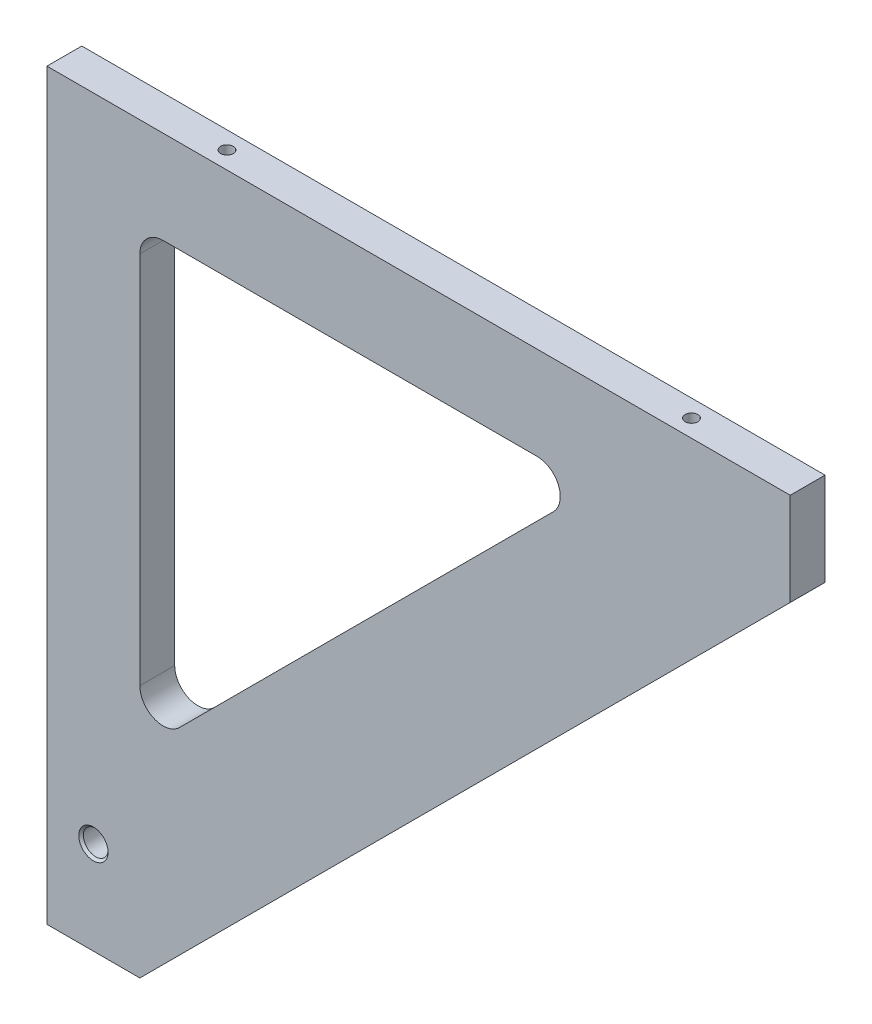
from build123d import *

# Parameters (mm, degrees)
BOSS_EXTRUDE1_DEPTH       = 4.7625
F_8_32_TAPPED_HOLE1_D     = 3.4544
F_8_32_TAPPED_HOLE1_DEPTH = 10.7188
F_8_32_TAPPED_HOLE1_TIP   = 1.037806461
CUT_EXTRUDE1_DEPTH        = 288.526008606
FILLET1_R                 = 6.35


with BuildPart() as part:
    # Sketch1 → Boss-Extrude1 (new, symmetric)
    with BuildSketch(Plane.XY):
        Polygon((0, -203.2), (0, 0), (203.2, 0), (203.2, -25.4), (25.4, -203.2), align=None)
    extrude(amount=BOSS_EXTRUDE1_DEPTH, both=True)

    # #8-32 Tapped Hole1
    with Locations(Plane(origin=(0, 0, 0), x_dir=(1, 0, 0), z_dir=(0, 1, 0))):
        with Locations((44.45, 0), (171.45, 0)):
            Hole(F_8_32_TAPPED_HOLE1_D / 2, depth=F_8_32_TAPPED_HOLE1_DEPTH)
            with Locations((0, 0, -(F_8_32_TAPPED_HOLE1_DEPTH + F_8_32_TAPPED_HOLE1_TIP / 2))):  # 118° drill point
                Cone(0, F_8_32_TAPPED_HOLE1_D / 2, F_8_32_TAPPED_HOLE1_TIP, mode=Mode.SUBTRACT)

    # Sketch6 → 1/4 Clearance Hole1 (revolve, cut)
    with BuildSketch(Plane(origin=(12.7, -177.8, 4.7625), x_dir=(0, -1, 0), z_dir=(1, 0, 0))):
        Polygon((0, 0), (0, 9.525), (4.0132, 9.525), (3.3782, 8.89), (3.3782, 0.635), (4.0132, 0), align=None)
    revolve(axis=Axis((12.7, -177.8, 11.1125), (0, 0, -1)), mode=Mode.SUBTRACT)

    # Sketch7 → Cut-Extrude1 (cut, through all)
    with BuildSketch(Plane.XY.offset(4.7625)):
        Polygon((25.4, -25.4), (25.4, -149.318463274), (149.318463274, -25.4), align=None)
    extrude(amount=-CUT_EXTRUDE1_DEPTH, mode=Mode.SUBTRACT)

    # Fillet1
    fillet1_edges = [part.edges().sort_by_distance(p)[0] for p in [
        (25.4, -149.318463274, 0),
        (149.318463274, -25.4, 0),
        (25.4, -25.4, 0),
    ]]
    fillet(fillet1_edges, radius=FILLET1_R)


solid = part.part
